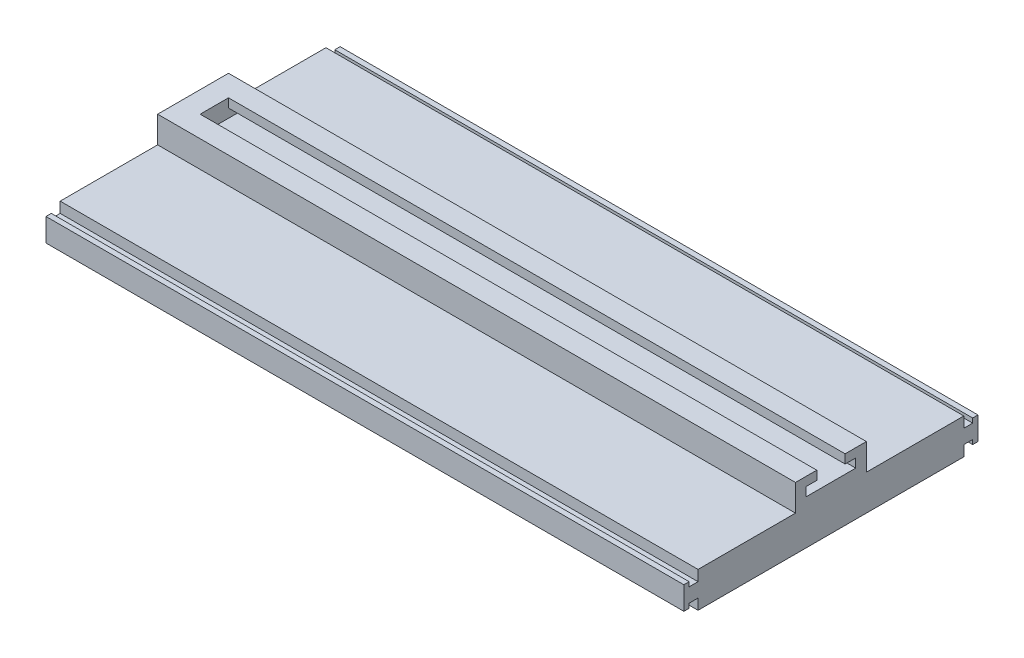
from build123d import *

# Parameters (mm, degrees)
SKETCH1_W                = 457.2
SKETCH1_H                = 190.5
BOSS_EXTRUDE1_DEPTH      = 25.4
SKETCH2_W                = 457.2
SKETCH2_H                = 10.16
BOSS_EXTRUDE2_DEPTH      = 10.16
BOSS_EXTRUDE3_START      = -13.335
SKETCH3_W                = 457.2
SKETCH3_H                = 3.81
BOSS_EXTRUDE3_DEPTH      = 16.51
SKETCH5_W                = 457.2
SKETCH5_H                = 50.8
BOSS_EXTRUDE4_DEPTH      = 19.05
SKETCH6_W                = 441.96
SKETCH6_H                = 20.32
CUT_EXTRUDE1_DEPTH       = 12.7
CUT_EXTRUDE2_DEPTH       = 27.94
CUT_EXTRUDE2_DEPTH_BACK  = 7.62
SKETCH7_W                = 441.96
SKETCH7_H                = 6.35
BOSS_EXTRUDE5_DEPTH      = 25.4
BOSS_EXTRUDE5_DEPTH_BACK = 25.4


with BuildPart() as part:
    # Sketch1 → Boss-Extrude1 (new body)
    with BuildSketch(Plane(origin=(0, 0, 0), x_dir=(1, 0, 0), z_dir=(0, 1, 0))):
        Rectangle(SKETCH1_W, SKETCH1_H)
    extrude(amount=BOSS_EXTRUDE1_DEPTH)

    # Sketch2 → Boss-Extrude2 (add)
    with BuildSketch(Plane.XY.offset(95.25)):
        with Locations((0, 12.7)):
            Rectangle(SKETCH2_W, SKETCH2_H)
    boss_extrude2 = extrude(amount=BOSS_EXTRUDE2_DEPTH)

    # Sketch3 → Boss-Extrude3 (add)
    with BuildSketch(Plane(origin=(0, 17.78, 0), x_dir=(1, 0, 0), z_dir=(0, 1, 0)).offset(BOSS_EXTRUDE3_START)):
        with Locations((0, -103.505)):
            Rectangle(SKETCH3_W, SKETCH3_H)
    boss_extrude3 = extrude(amount=BOSS_EXTRUDE3_DEPTH)

    # Mirror1: Boss-Extrude2, Boss-Extrude3 across plane
    add(boss_extrude2.mirror(Plane.XY))
    add(boss_extrude3.mirror(Plane.XY))

    # Sketch5 → Boss-Extrude4 (add)
    with BuildSketch(Plane(origin=(0, 25.4, 0), x_dir=(1, 0, 0), z_dir=(0, 1, 0))):
        Rectangle(SKETCH5_W, SKETCH5_H)
    extrude(amount=BOSS_EXTRUDE4_DEPTH)

    # Sketch6 → Cut-Extrude1 (cut)
    with BuildSketch(Plane(origin=(0, 44.45, 0), x_dir=(1, 0, 0), z_dir=(0, 1, 0))):
        with Locations((7.62, 0)):
            Rectangle(SKETCH6_W, SKETCH6_H)
    extrude(amount=-CUT_EXTRUDE1_DEPTH, mode=Mode.SUBTRACT)

    # Sketch7 → Cut-Extrude2 (cut, two sides: drawn at the far end of the back side and taken through both)
    with BuildSketch(Plane(origin=(0, 0, 10.16), x_dir=(-1, 0, 0), z_dir=(0, 0, -1)).offset(-CUT_EXTRUDE2_DEPTH_BACK)):
        with Locations((-7.62, 34.925)):
            Rectangle(SKETCH7_W, SKETCH7_H)
    extrude(amount=CUT_EXTRUDE2_DEPTH + CUT_EXTRUDE2_DEPTH_BACK, mode=Mode.SUBTRACT)

    # Sketch8 → Boss-Extrude5 (add, two sides: drawn at the far end of the back side and taken through both)
    with BuildSketch(Plane.XY.offset(-BOSS_EXTRUDE5_DEPTH_BACK)):
        Polygon((44.081942035, 0), (-32.118057965, 0), (-25.4, -38.1), align=None)
    extrude(amount=BOSS_EXTRUDE5_DEPTH + BOSS_EXTRUDE5_DEPTH_BACK)


solid = part.part
